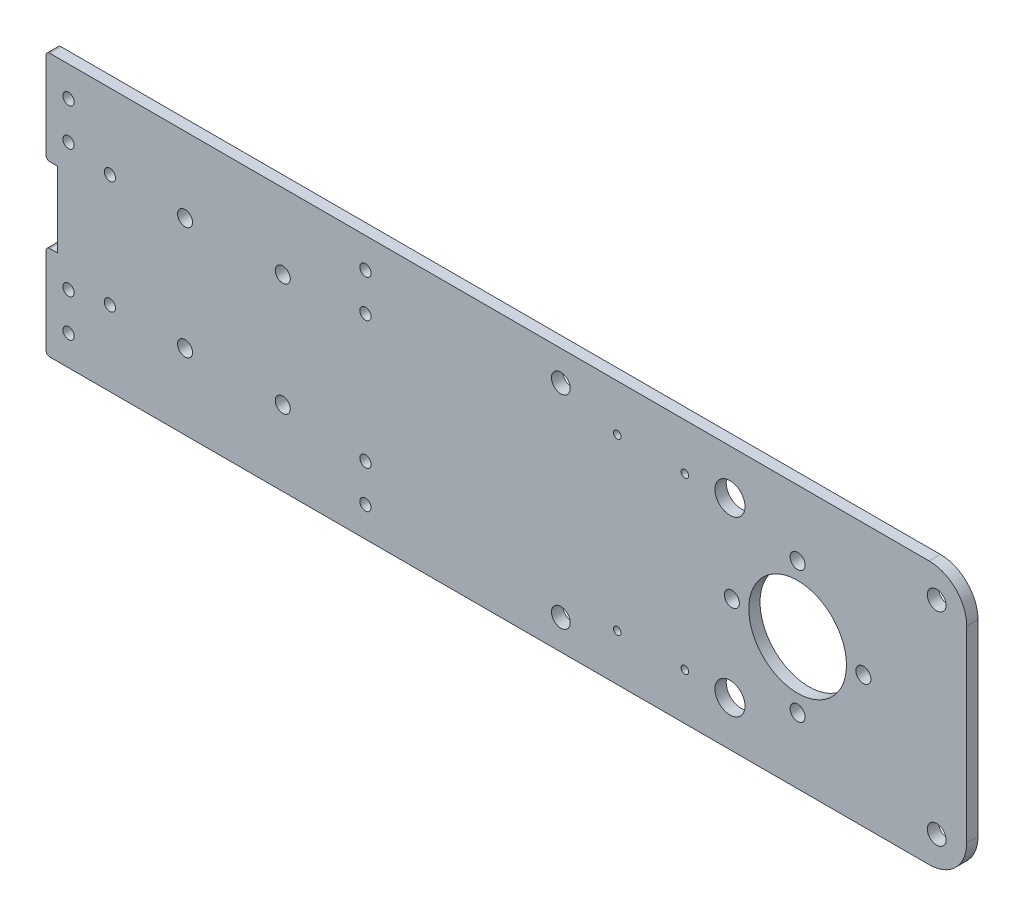
from build123d import *

# Parameters (mm, degrees)
SKETCH_1_W                = 245
SKETCH_1_H                = 70
EXTRUDE_1_DEPTH           = 3
SKETCH_3_R                = 2
CUT_EXTRUDE_2_DEPTH       = 128.437239455
SKETCH_5_W                = 3
SKETCH_5_H                = 20
CUT_EXTRUDE_4_DEPTH       = 128.437239455
FILLET_1_R                = 1
SKETCH_6_R                = 1.5
CUT_EXTRUDE_5_DEPTH       = 128.437239455
SKETCH_7_R                = 1.5
CUT_EXTRUDE_6_DEPTH       = 128.437239455
SKETCH_8_R                = 1.5
CUT_EXTRUDE_7_DEPTH       = 128.437239455
SKETCH_9_R                = 13
CUT_EXTRUDE_8_DEPTH       = 128.437239455
SKETCH_10_R               = 2
CUT_EXTRUDE_9_DEPTH       = 128.437239455
FILLET_2_R                = 10
SKETCH_11_R               = 2.5
CUT_EXTRUDE_10_DEPTH      = 128.437239455
CUT_EXTRUDE_11_DEPTH      = 128.437239455
CUT_EXTRUDE_11_DEPTH_BACK = 128.437239455
SKETCH_12_R               = 4
SKETCH_13_R               = 1
CUT_EXTRUDE_12_DEPTH      = 128.437239455


with BuildPart() as part:
    # 草图1 → 凸台-拉伸1 (new body)
    with BuildSketch(Plane.XY):
        Rectangle(SKETCH_1_W, SKETCH_1_H)
    extrude(amount=EXTRUDE_1_DEPTH)

    # 草图3 → 切除-拉伸2 (cut, through all)
    with BuildSketch(Plane.XY.offset(3)):
        with Locations((-85.5, 15)):
            Circle(SKETCH_3_R)
        with Locations(Location((-59.5, 15, 0), (0, 0, 180))):
            Circle(SKETCH_3_R)
        with Locations((-59.5, -15)):
            Circle(SKETCH_3_R)
        with Locations(Location((-85.5, -15, 0), (0, 0, 180))):
            Circle(SKETCH_3_R)
    extrude(amount=-CUT_EXTRUDE_2_DEPTH, mode=Mode.SUBTRACT)

    # 草图5 → 切除-拉伸4 (cut, through all)
    with BuildSketch(Plane.XY.offset(3)):
        with Locations((-121, 0)):
            Rectangle(SKETCH_5_W, SKETCH_5_H)
    extrude(amount=-CUT_EXTRUDE_4_DEPTH, mode=Mode.SUBTRACT)

    # 圆角1
    fillet_1_edges = [part.edges().sort_by_distance(p)[0] for p in [
        (-122.5, -10, 1.5),
        (-122.5, 10, 1.5),
        (-122.5, -35, 1.5),
        (-122.5, 35, 1.5),
    ]]
    fillet(fillet_1_edges, radius=FILLET_1_R)

    # 草图6 → 切除-拉伸5 (cut, through all)
    with BuildSketch(Plane.XY.offset(3)):
        with Locations((-116.5, 27)):
            Circle(SKETCH_6_R)
        with Locations((-116.5, 17)):
            Circle(SKETCH_6_R)
        with Locations(Location((-116.5, -17, 0), (0, 0, 180))):
            Circle(SKETCH_6_R)
        with Locations(Location((-116.5, -27, 0), (0, 0, 180))):
            Circle(SKETCH_6_R)
    extrude(amount=-CUT_EXTRUDE_5_DEPTH, mode=Mode.SUBTRACT)

    # 草图7 → 切除-拉伸6 (cut, through all)
    with BuildSketch(Plane.XY.offset(3)):
        with Locations((-105.5, 15)):
            Circle(SKETCH_7_R)
        with Locations(Location((-105.5, -15, 0), (0, 0, 180))):
            Circle(SKETCH_7_R)
    extrude(amount=-CUT_EXTRUDE_6_DEPTH, mode=Mode.SUBTRACT)

    # 草图8 → 切除-拉伸7 (cut, through all)
    with BuildSketch(Plane.XY.offset(3)):
        with Locations((-37.5, 27)):
            Circle(SKETCH_8_R)
        with Locations((-37.5, 17)):
            Circle(SKETCH_8_R)
        with Locations(Location((-37.5, -17, 0), (0, 0, 180))):
            Circle(SKETCH_8_R)
        with Locations(Location((-37.5, -27, 0), (0, 0, 180))):
            Circle(SKETCH_8_R)
    extrude(amount=-CUT_EXTRUDE_7_DEPTH, mode=Mode.SUBTRACT)

    # 草图9 → 切除-拉伸8 (cut, through all)
    with BuildSketch(Plane.XY.offset(3)):
        with Locations((77.5, 0)):
            Circle(SKETCH_9_R)
    extrude(amount=-CUT_EXTRUDE_8_DEPTH, mode=Mode.SUBTRACT)

    # 草图10 → 切除-拉伸9 (cut, through all)
    with BuildSketch(Plane.XY.offset(3)):
        with Locations((77.5, 17.5)):
            Circle(SKETCH_10_R)
        with Locations((60, 0)):
            Circle(SKETCH_10_R)
        with Locations(Location((95, 0, 0), (0, 0, 180))):
            Circle(SKETCH_10_R)
        with Locations(Location((77.5, -17.5, 0), (0, 0, 180))):
            Circle(SKETCH_10_R)
    extrude(amount=-CUT_EXTRUDE_9_DEPTH, mode=Mode.SUBTRACT)

    # 圆角2
    fillet_2_edges = [part.edges().sort_by_distance(p)[0] for p in [
        (122.5, -35, 1.5),
        (122.5, 35, 1.5),
    ]]
    fillet(fillet_2_edges, radius=FILLET_2_R)

    # 草图11 → 切除-拉伸10 (cut, through all)
    with BuildSketch(Plane(origin=(0, 0, 0), x_dir=(-1, 0, 0), z_dir=(0, 0, -1))):
        with Locations((-114.5, 27)):
            Circle(SKETCH_11_R)
        with Locations((-14.5, 27)):
            Circle(SKETCH_11_R)
        with Locations(Location((-14.5, -27, 0), (0, 0, 180))):
            Circle(SKETCH_11_R)
        with Locations(Location((-114.5, -27, 0), (0, 0, 180))):
            Circle(SKETCH_11_R)
    extrude(amount=-CUT_EXTRUDE_10_DEPTH, mode=Mode.SUBTRACT)

    # 草图12 → 切除-拉伸11 (cut, two sides: drawn at the far end of the back side and taken through both)
    with BuildSketch(Plane(origin=(0, 0, 0), x_dir=(-1, 0, 0), z_dir=(0, 0, -1)).offset(-CUT_EXTRUDE_11_DEPTH_BACK)):
        with Locations((-59.5, 23)):
            Circle(SKETCH_12_R)
        with Locations(Location((-59.5, -23, 0), (0, 0, 180))):
            Circle(SKETCH_12_R)
    extrude(amount=CUT_EXTRUDE_11_DEPTH + CUT_EXTRUDE_11_DEPTH_BACK, mode=Mode.SUBTRACT)

    # 草图13 → 切除-拉伸12 (cut, through all)
    with BuildSketch(Plane(origin=(0, 0, 0), x_dir=(-1, 0, 0), z_dir=(0, 0, -1))):
        with Locations((-47.5, 22.6)):
            Circle(SKETCH_13_R)
        with Locations((-29.5, 22.6)):
            Circle(SKETCH_13_R)
        with Locations(Location((-29.5, -22.6, 0), (0, 0, 180))):
            Circle(SKETCH_13_R)
        with Locations(Location((-47.5, -22.6, 0), (0, 0, 180))):
            Circle(SKETCH_13_R)
    extrude(amount=-CUT_EXTRUDE_12_DEPTH, mode=Mode.SUBTRACT)


solid = part.part
